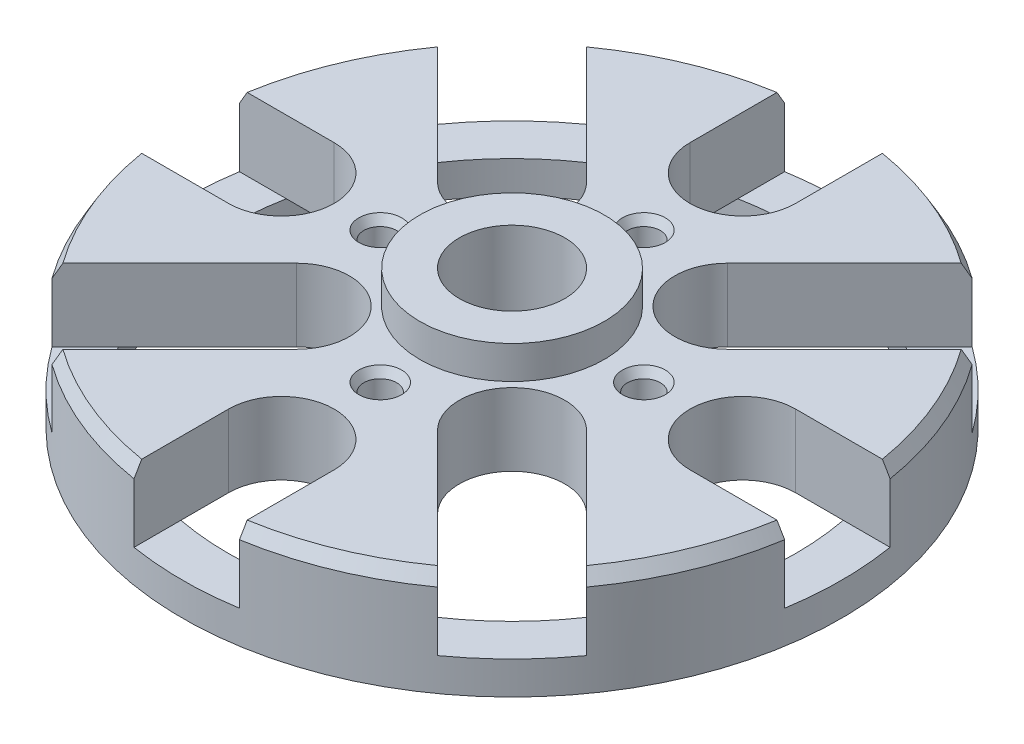
from build123d import *

# Parameters (mm, degrees)
SKETCH2_R                       = 25
BOSS_EXTRUDE1_DEPTH             = 5.5
CHAMFER1_SIZE                   = 1
CHAMFER1_SIZE2                  = 0.577350269
SKETCH3_R                       = 7
BOSS_EXTRUDE2_DEPTH             = 2.5
M3X0_5_TAPPED_HOLE1_D           = 2.5
M3X0_5_TAPPED_HOLE1_CSINK_D     = 3.25
M3X0_5_TAPPED_HOLE1_CSINK_ANGLE = 60
SKETCH8_R                       = 4
CUT_EXTRUDE1_DEPTH              = 37.249137921
CUT_EXTRUDE2_DEPTH              = 36.780581326
CUT_EXTRUDE3_DEPTH              = 36.780581326
CIRPATTERN1_COUNT               = 4
BOSS_EXTRUDE3_START             = 2.5
SKETCH11_R                      = 25
SKETCH11_R_2                    = 21.5
BOSS_EXTRUDE3_DEPTH             = 2.5


with BuildPart() as part:
    # Sketch2 → Boss-Extrude1 (new body)
    with BuildSketch(Plane(origin=(0, 0, 0), x_dir=(1, 0, 0), z_dir=(0, 1, 0))):
        with Locations(Location((0, 0, 0), (0, 0, 270))):
            Circle(SKETCH2_R)
    extrude(amount=BOSS_EXTRUDE1_DEPTH)

    # Chamfer1
    chamfer1_edges = [part.edges().sort_by_distance(p)[0] for p in [
        (0, 5.5, -25),
    ]]
    chamfer1_side = [part.faces().sort_by_distance(p)[0] for p in [
        (0, 2.75, -25),
    ]]
    chamfer(chamfer1_edges, length=CHAMFER1_SIZE, length2=CHAMFER1_SIZE2, reference=chamfer1_side[0])

    # Sketch3 → Boss-Extrude2 (add)
    with BuildSketch(Plane(origin=(0, 5.5, 0), x_dir=(1, 0, 0), z_dir=(0, 1, 0))):
        with Locations(Location((0, 0, 0), (0, 0, 270))):
            Circle(SKETCH3_R)
    extrude(amount=BOSS_EXTRUDE2_DEPTH)

    # M3x0.5 Tapped Hole1 (through all)
    with Locations(Plane(origin=(0, 5.5, 0), x_dir=(1, 0, 0), z_dir=(0, 1, 0))):
        with Locations((0, 10)):
            m3x0_5_tapped_hole1 = CounterSinkHole(M3X0_5_TAPPED_HOLE1_D / 2, M3X0_5_TAPPED_HOLE1_CSINK_D / 2, counter_sink_angle=M3X0_5_TAPPED_HOLE1_CSINK_ANGLE)

    # Sketch8 → Cut-Extrude1 (cut, through all)
    with BuildSketch(Plane(origin=(0, 8, 0), x_dir=(1, 0, 0), z_dir=(0, 1, 0))):
        with Locations(Location((0, 0, 0), (0, 0, 270))):
            Circle(SKETCH8_R)
    extrude(amount=-CUT_EXTRUDE1_DEPTH, mode=Mode.SUBTRACT)

    # Sketch9 → Cut-Extrude2 (cut, through all)
    with BuildSketch(Plane(origin=(0, 5.5, 0), x_dir=(1, 0, 0), z_dir=(0, 1, 0))):
        with BuildLine():
            Line((4, 32.5), (4, 17.5))
            ThreePointArc((4, 17.5), (0, 13.5), (-4, 17.5))
            Line((-4, 17.5), (-4, 32.5))
            ThreePointArc((-4, 32.5), (0, 36.5), (4, 32.5))
        make_face()
    cut_extrude2 = extrude(amount=-CUT_EXTRUDE2_DEPTH, mode=Mode.SUBTRACT)

    # Sketch10 → Cut-Extrude3 (cut, through all)
    with BuildSketch(Plane(origin=(0, 5.5, 0), x_dir=(1, 0, 0), z_dir=(0, 1, 0))):
        with BuildLine():
            Line((-23.539452544, 29.196306793), (-5.342535685, 10.999389935))
            ThreePointArc((-5.342535685, 10.999389935), (-5.342535685, 5.342535685), (-10.999389935, 5.342535685))
            Line((-10.999389935, 5.342535685), (-29.196306793, 23.539452544))
            ThreePointArc((-29.196306793, 23.539452544), (-29.196306793, 29.196306793), (-23.539452544, 29.196306793))
        make_face()
    cut_extrude3 = extrude(amount=-CUT_EXTRUDE3_DEPTH, mode=Mode.SUBTRACT)

    # CirPattern1: M3x0.5 Tapped Hole1, Cut-Extrude2, Cut-Extrude3 ×4 about axis
    cirpattern1_axis = Axis((0, 0, 0), (0, 1, 0))
    add([m3x0_5_tapped_hole1.rotate(cirpattern1_axis, i * 360 / CIRPATTERN1_COUNT) for i in range(1, CIRPATTERN1_COUNT)], mode=Mode.SUBTRACT)
    add([cut_extrude2.rotate(cirpattern1_axis, i * 360 / CIRPATTERN1_COUNT) for i in range(1, CIRPATTERN1_COUNT)], mode=Mode.SUBTRACT)
    add([cut_extrude3.rotate(cirpattern1_axis, i * 360 / CIRPATTERN1_COUNT) for i in range(1, CIRPATTERN1_COUNT)], mode=Mode.SUBTRACT)

    # Sketch11 → Boss-Extrude3 (add)
    with BuildSketch(Plane.XZ.offset(BOSS_EXTRUDE3_START)):
        with Locations(Location((0, 0, 0), (0, 0, 270))):
            Circle(SKETCH11_R)
        with Locations(Location((0, 0, 0), (0, 0, 79.277847584))):
            Circle(SKETCH11_R_2, mode=Mode.SUBTRACT)
    extrude(amount=-BOSS_EXTRUDE3_DEPTH)


solid = part.part
